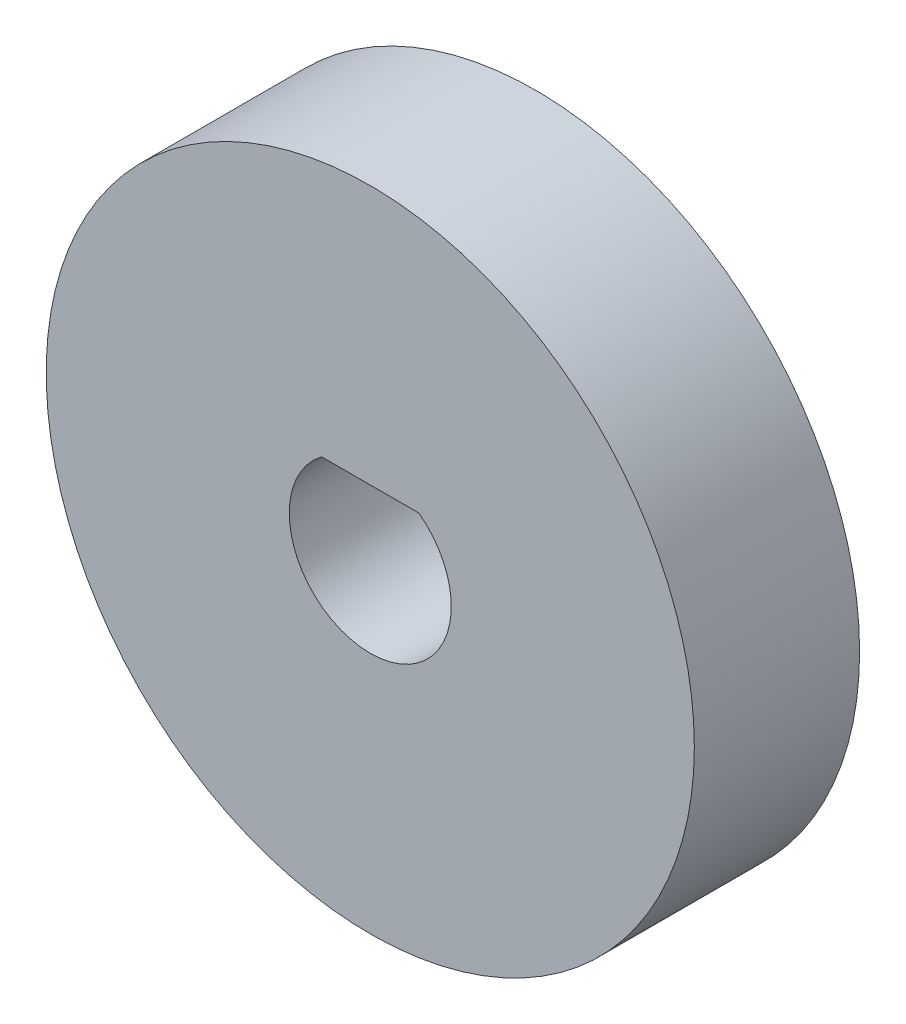
from build123d import *

# Parameters (mm, degrees)
SKETCH1_R           = 10
BOSS_EXTRUDE1_DEPTH = 5.1


with BuildPart() as part:
    # Sketch1 → Boss-Extrude1 (new body)
    with BuildSketch(Plane.XY):
        Circle(SKETCH1_R)
        with BuildLine():
            Line((-1.5, 2), (1.5, 2))
            ThreePointArc((1.5, 2), (0, -2.5), (-1.5, 2))
        make_face(mode=Mode.SUBTRACT)
    extrude(amount=BOSS_EXTRUDE1_DEPTH)


solid = part.part
